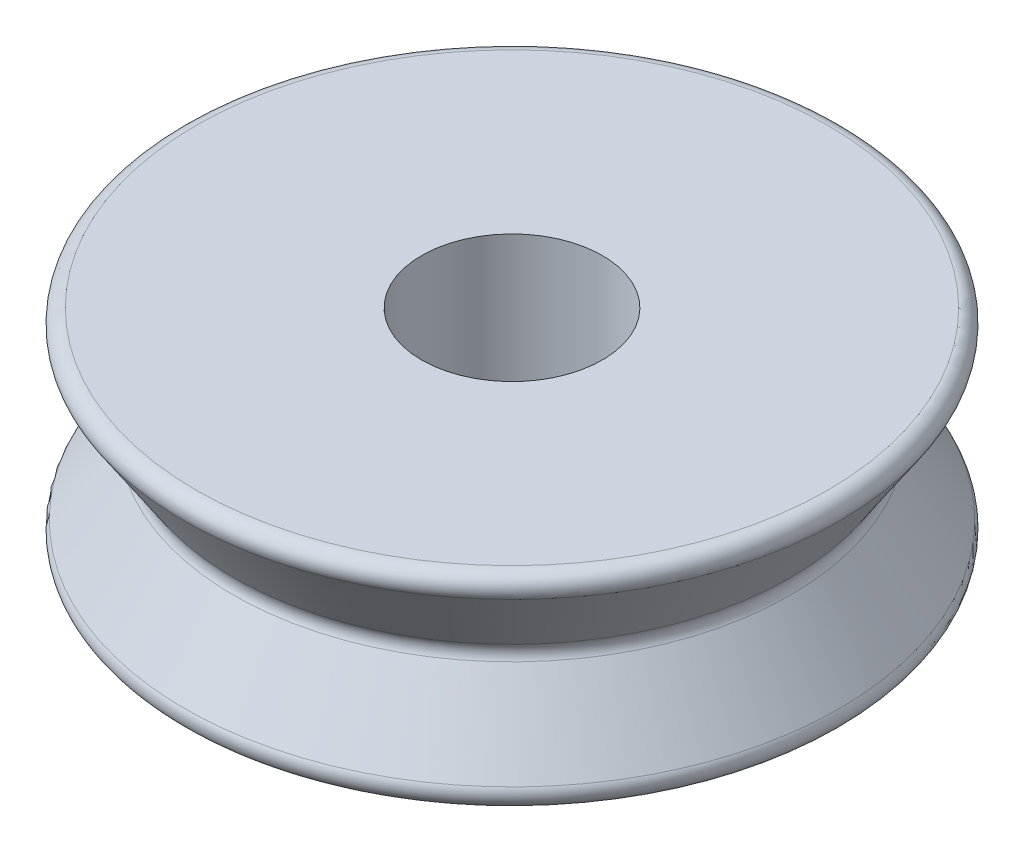
from build123d import *

# Parameters (mm, degrees)
CONG_1_R         = 0.4
D_GAGEMENT_M51_D = 5.3


with BuildPart() as part:
    # Esquisse2 → Révolution1 (revolve)
    with BuildSketch(Plane.XY):
        Polygon((-10, 3), (-8, 0), (-10, -3), (0, -3), (0, 3), align=None)
    revolve(axis=Axis((0, 3, 0), (0, -1, 0)))

    # Congé1
    cong_1_edges = [part.edges().sort_by_distance(p)[0] for p in [
        (10, 3, 0),
        (8, 0, 0),
        (10, -3, 0),
    ]]
    fillet(cong_1_edges, radius=CONG_1_R)

    # Dégagement M51 (through all)
    with Locations(Plane(origin=(0, 3, 0), x_dir=(1, 0, 0), z_dir=(0, 1, 0))):
        with Locations((0, 0)):
            Hole(D_GAGEMENT_M51_D / 2)


solid = part.part
